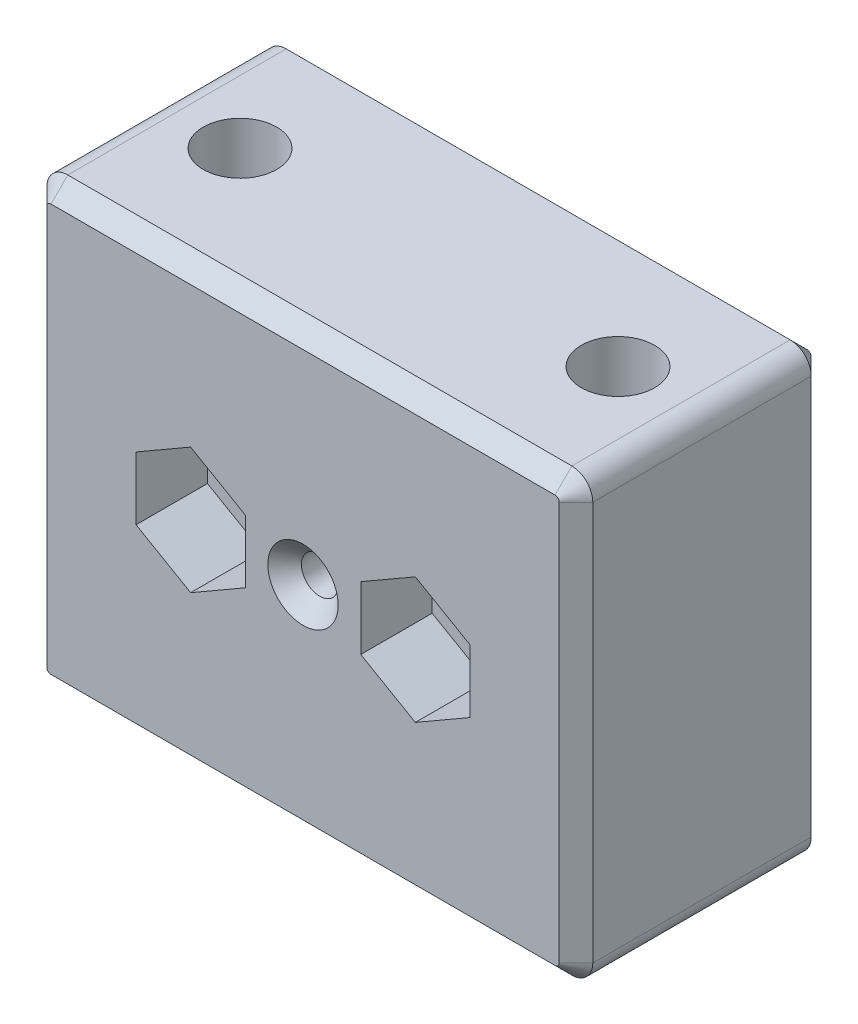
from build123d import *

# Parameters (mm, degrees)
CROQUIS1_W                 = 26
CROQUIS1_H                 = 21
SALIENTE_EXTRUIR1_DEPTH    = 6
CORTAR_EXTRUIR1_DEPTH      = 26.416530054
CORTAR_EXTRUIR1_DEPTH_BACK = 26.416530054
CROQUIS2_R                 = 1.75
CROQUIS3_R                 = 0.875
CORTAR_EXTRUIR2_DEPTH      = 15
REDONDEO1_R                = 1
CHAFL_N1_SIZE              = 0.8
CHAFL_N2_SIZE              = 0.8
CORTAR_EXTRUIR3_DEPTH      = 3.4
CROQUIS5_R                 = 1.7
CORTAR_EXTRUIR4_DEPTH      = 40


with BuildPart() as part:
    # Croquis1 → Saliente-Extruir1 (new, symmetric)
    with BuildSketch(Plane.XY):
        Rectangle(CROQUIS1_W, CROQUIS1_H)
    extrude(amount=SALIENTE_EXTRUIR1_DEPTH, both=True)

    # Croquis2 → Cortar-Extruir1 (cut, two sides: drawn at the far end of the back side and taken through both)
    with BuildSketch(Plane.XZ.offset(10.5).offset(-CORTAR_EXTRUIR1_DEPTH_BACK)):
        with Locations(Location((-9, 0, 0), (0, 0, 270))):
            Circle(CROQUIS2_R)
        with Locations(Location((9, 0, 0), (0, 0, 270))):
            Circle(CROQUIS2_R)
    extrude(amount=CORTAR_EXTRUIR1_DEPTH + CORTAR_EXTRUIR1_DEPTH_BACK, mode=Mode.SUBTRACT)

    # Croquis3 → Cortar-Extruir2 (cut)
    with BuildSketch(Plane.XY.offset(6)):
        Circle(CROQUIS3_R)
    extrude(amount=-CORTAR_EXTRUIR2_DEPTH, mode=Mode.SUBTRACT)

    # Redondeo1
    redondeo1_edges = [part.edges().sort_by_distance(p)[0] for p in [
        (13, -10.5, 0),
        (-13, -10.5, 0),
        (-13, 10.5, 0),
        (13, 10.5, 0),
    ]]
    fillet(redondeo1_edges, radius=REDONDEO1_R)

    # Chaflán1
    chafl_n1_edges = [part.edges().sort_by_distance(p)[0] for p in [
        (0, 10.5, -6),
        (0, 10.5, 6),
        (13, 0, -6),
        (0, -10.5, -6),
        (-13, 0, -6),
        (-12.707106781, -10.207106781, -6),
        (12.707106781, -10.207106781, -6),
        (-12.707106781, 10.207106781, -6),
        (12.707106781, 10.207106781, -6),
        (13, 0, 6),
        (-13, 0, 6),
        (0, -10.5, 6),
        (-12.707106781, -10.207106781, 6),
        (12.707106781, -10.207106781, 6),
        (-12.707106781, 10.207106781, 6),
        (12.707106781, 10.207106781, 6),
    ]]
    chamfer(chafl_n1_edges, length=CHAFL_N1_SIZE)

    # Chaflán2
    chafl_n2_edges = [part.edges().sort_by_distance(p)[0] for p in [
        (-0.875, 0, -6),
        (-0.875, 0, 6),
    ]]
    chamfer(chafl_n2_edges, length=CHAFL_N2_SIZE)

    # Croquis4 → Cortar-Extruir3 (cut)
    with BuildSketch(Plane.XY.offset(6)):
        Polygon((-5.35, 3.0022214), (-7.95, 1.5011107), (-7.95, -1.5011107), (-5.35, -3.0022214), (-2.75, -1.5011107), (-2.75, 1.5011107), align=None)
        Polygon((5.35, 3.0022214), (2.75, 1.5011107), (2.75, -1.5011107), (5.35, -3.0022214), (7.95, -1.5011107), (7.95, 1.5011107), align=None)
    extrude(amount=-CORTAR_EXTRUIR3_DEPTH, mode=Mode.SUBTRACT)

    # Croquis5 → Cortar-Extruir4 (cut)
    with BuildSketch(Plane.XY.offset(2.6)):
        with Locations((5.35, 0)):
            Circle(CROQUIS5_R)
        with Locations((-5.35, 0)):
            Circle(CROQUIS5_R)
    extrude(amount=-CORTAR_EXTRUIR4_DEPTH, mode=Mode.SUBTRACT)


solid = part.part
